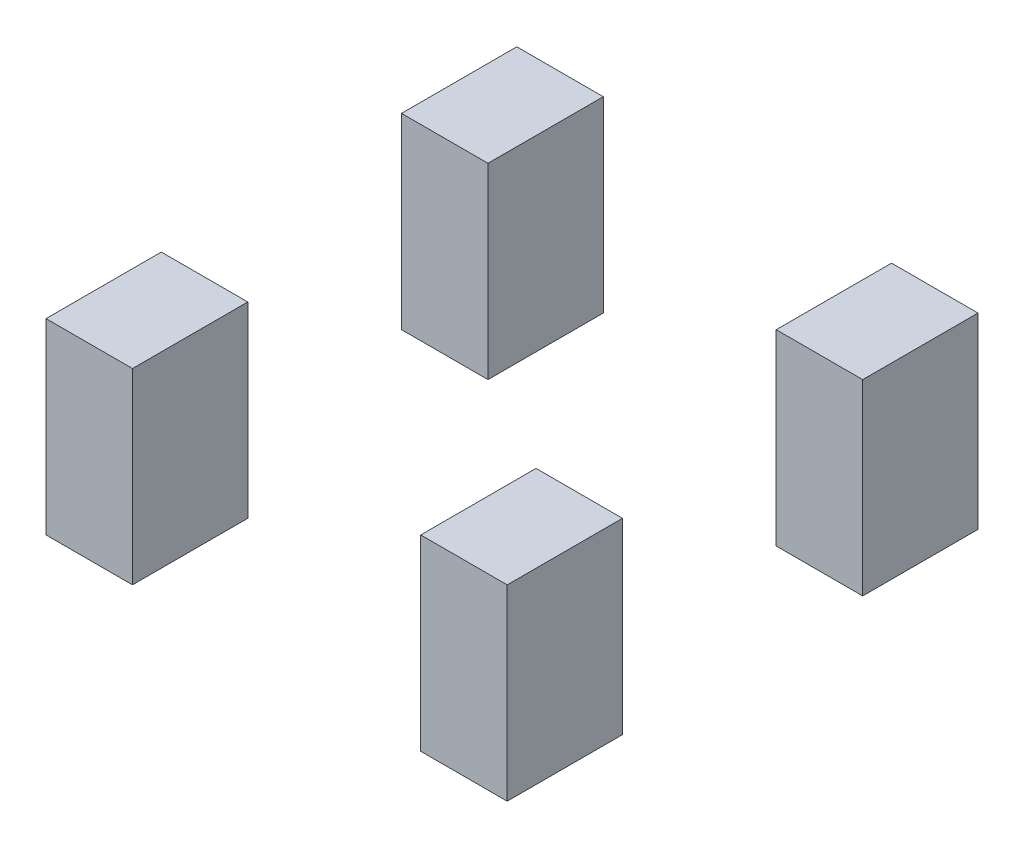
from build123d import *

# Parameters (mm, degrees)
SKETCH1_W             = 90
SKETCH1_H             = 120
BOSS_EXTRUDE1_DEPTH   = 195
BOSS_EXTRUDE1_2_DEPTH = 195
BOSS_EXTRUDE1_3_DEPTH = 195
BOSS_EXTRUDE1_4_DEPTH = 195


with BuildPart() as part:
    # Sketch1 → Boss-Extrude1 (new body)
    with BuildSketch(Plane(origin=(0, 0, 0), x_dir=(1, 0, 0), z_dir=(0, 1, 0))):
        with Locations((-1669.81443299, -5380.494050863)):
            Rectangle(SKETCH1_W, SKETCH1_H)
    extrude(amount=BOSS_EXTRUDE1_DEPTH)


with BuildPart() as body_2:
    # Sketch1 → Boss-Extrude1 2 (new body)
    with BuildSketch(Plane(origin=(0, 0, 0), x_dir=(1, 0, 0), z_dir=(0, 1, 0))):
        with Locations((-1669.81443299, -5010.494050863)):
            Rectangle(SKETCH1_W, SKETCH1_H)
    extrude(amount=BOSS_EXTRUDE1_2_DEPTH)


with BuildPart() as body_3:
    # Sketch1 → Boss-Extrude1 3 (new body)
    with BuildSketch(Plane(origin=(0, 0, 0), x_dir=(1, 0, 0), z_dir=(0, 1, 0))):
        with Locations((-1279.81443299, -5010.494050863)):
            Rectangle(SKETCH1_W, SKETCH1_H)
    extrude(amount=BOSS_EXTRUDE1_3_DEPTH)


with BuildPart() as body_4:
    # Sketch1 → Boss-Extrude1 4 (new body)
    with BuildSketch(Plane(origin=(0, 0, 0), x_dir=(1, 0, 0), z_dir=(0, 1, 0))):
        with Locations((-1279.81443299, -5380.494050863)):
            Rectangle(SKETCH1_W, SKETCH1_H)
    extrude(amount=BOSS_EXTRUDE1_4_DEPTH)


solid = Compound([part.part, body_2.part, body_3.part, body_4.part])
